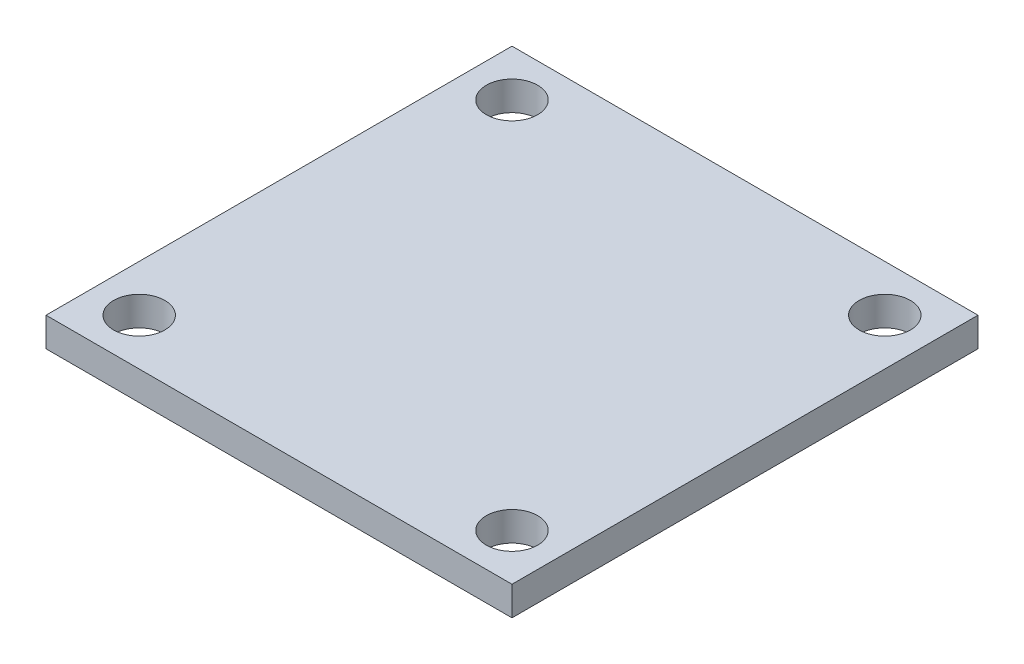
from build123d import *

# Parameters (mm, degrees)
ESBO_O1_W                 = 200
ESBO_O1_H                 = 200
RESSALTO_EXTRUS_O1_DEPTH  = 12.5
ESBO_O2_R                 = 11
CORTE_EXTRUS_O1_DEPTH     = 142.972708645
PADR_O_LINEAR1_COUNT      = 2
PADR_O_LINEAR1_PITCH      = 160
PADR_O_LINEAR1_COUNT_DIR2 = 2
PADR_O_LINEAR1_PITCH_DIR2 = 160


with BuildPart() as part:
    # Esboço1 → Ressalto-extrusão1 (new body)
    with BuildSketch(Plane(origin=(0, 0, 0), x_dir=(1, 0, 0), z_dir=(0, 1, 0))):
        Rectangle(ESBO_O1_W, ESBO_O1_H)
    extrude(amount=RESSALTO_EXTRUS_O1_DEPTH)

    # Esboço2 → Corte-extrusão1 (cut, through all)
    with BuildSketch(Plane(origin=(0, 12.5, 0), x_dir=(1, 0, 0), z_dir=(0, 1, 0))):
        with Locations(Location((-80, 80, 0), (0, 0, 270))):
            Circle(ESBO_O2_R)
    corte_extrus_o1 = extrude(amount=-CORTE_EXTRUS_O1_DEPTH, mode=Mode.SUBTRACT)

    # Padrão linear1: Corte-extrus_o1 2 × 2
    with Locations(*[(i * PADR_O_LINEAR1_PITCH, 0, j * PADR_O_LINEAR1_PITCH_DIR2) for i in range(PADR_O_LINEAR1_COUNT) for j in range(PADR_O_LINEAR1_COUNT_DIR2) if (i, j) != (0, 0)]):
        add(corte_extrus_o1, mode=Mode.SUBTRACT)


solid = part.part
